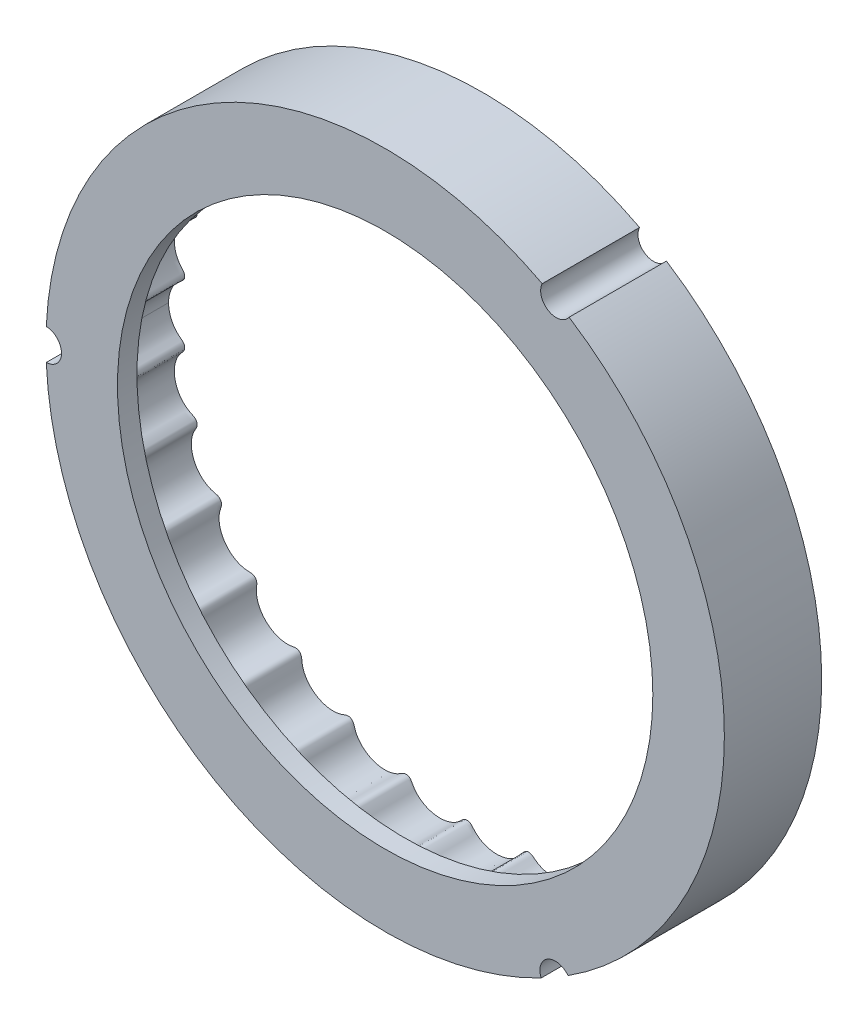
from build123d import *

# Parameters (mm, degrees)
ESQUISSE1_R             = 34.85
BOSS_EXTRU_1_DEPTH      = 8
ESQUISSE3_R             = 34.85
ESQUISSE3_R_2           = 27.5
BOSS_EXTRU_2_DEPTH      = 2
ESQUISSE4_R             = 1.6
ENL_V_MAT_EXTRU_2_DEPTH = 51.289611412


with BuildPart() as part:
    # Esquisse1 → Boss.-Extru.1 (new body)
    with BuildSketch(Plane.XY):
        Circle(ESQUISSE1_R)
        with BuildLine():
            add(Edge.make_bspline(
                [(30.75, 0), (30.75, -0.012466551), (30.750978291, -0.037435326), (30.755380523, -0.087337177), (30.767021407, -0.146605526), (30.784235638, -0.201639987), (30.806725403, -0.255918868), (30.840935147, -0.321123985), (30.887422434, -0.389111538), (30.947096406, -0.458089435), (31.018450958, -0.527969594), (31.087642774, -0.591592772), (31.173963904, -0.671262461), (31.275013947, -0.769628319), (31.418667793, -0.925049962), (31.590505656, -1.149287713), (31.765198528, -1.440584759), (31.922692534, -1.804453032), (32.034958648, -2.194853386), (32.098455422, -2.605847675), (32.110893976, -3.018484836), (32.074041221, -3.426596924), (31.989674774, -3.824502644), (31.859579575, -4.20675551), (31.685835108, -4.56634961), (31.470950798, -4.897742168), (31.24907067, -5.158368371), (31.037624658, -5.355859269), (30.846956876, -5.502834102), (30.686542549, -5.609708869), (30.511303765, -5.713032229), (30.327949226, -5.826454032), (30.173095555, -5.998578141), (30.093232003, -6.229100949), (30.110193836, -6.460044438), (30.200515583, -6.65648558), (30.319195295, -6.81880241), (30.429591873, -6.972377134), (30.556884573, -7.171669121), (30.686990471, -7.42432627), (30.81051827, -7.752064551), (30.902306801, -8.157965927), (30.939306602, -8.590969655), (30.91541063, -9.043225199), (30.833120238, -9.47917927), (30.698564824, -9.892214886), (30.517499761, -10.276882491), (30.295359778, -10.628695383), (30.03663758, -10.942013482), (29.746966061, -11.212937701), (29.470433337, -11.410145285), (29.223317503, -11.547196269), (29.007991406, -11.641437129), (28.831489277, -11.706780195), (28.642058234, -11.769172318), (28.450045732, -11.863081746), (28.288329456, -12.026987259), (28.210287752, -12.224918325), (28.20346133, -12.405406571), (28.236785614, -12.570096872), (28.293783104, -12.715821968), (28.367996779, -12.873214243), (28.441734352, -13.051374202), (28.519282743, -13.279422724), (28.585875989, -13.561168059), (28.625891413, -13.901400281), (28.620176022, -14.296757725), (28.564173119, -14.692691042), (28.458894502, -15.083143097), (28.307859188, -15.458096406), (28.113801834, -15.812569773), (27.879487833, -16.141681779), (27.607733235, -16.440542983), (27.304935504, -16.701120752), (26.975605605, -16.919348027), (26.668066278, -17.069716959), (26.395293942, -17.166332894), (26.161761798, -17.224796282), (25.972001086, -17.258905238), (25.77009755, -17.283912083), (25.556930978, -17.318589654), (25.348986278, -17.421268885), (25.189696924, -17.606062532), (25.120163479, -17.826984077), (25.130694209, -18.042573767), (25.176826858, -18.238110843), (25.216893076, -18.422953837), (25.254028667, -18.656404758), (25.272254044, -18.939939771), (25.254622928, -19.289611344), (25.176827173, -19.698288661), (25.038154347, -20.109986708), (24.836067152, -20.515105141), (24.583785661, -20.886782695), (24.287592504, -21.219855725), (23.953496641, -21.509650647), (23.587386146, -21.751686499), (23.210135668, -21.933657843), (22.873869304, -22.043643078), (22.591374487, -22.102148479), (22.325158766, -22.133594977), (22.101571409, -22.140706228), (21.878531137, -22.127472643), (21.64366765, -22.109610546), (21.438911553, -22.128790646), (21.235010271, -22.221372978), (21.072081402, -22.396691751), (20.993021331, -22.612875938), (20.985637564, -22.829397015), (20.992657275, -23.032781427), (20.989114789, -23.225634535), (20.969103016, -23.465571964), (20.917534051, -23.750425404), (20.818402107, -24.078217858), (20.655461136, -24.438354859), (20.446318236, -24.77898339), (20.131259913, -25.173976814), (19.681623457, -25.583288583), (19.159101878, -25.898679173), (18.590417327, -26.101603516), (18.101715984, -26.187940575), (17.759635951, -26.202985797), (17.470900281, -26.182588302), (17.23345446, -26.142771473), (17.045752759, -26.098427136), (16.850546694, -26.04105894), (16.639855437, -25.991807329), (16.410596194, -26.010096582), (16.197941083, -26.119984154), (16.054054554, -26.291655725), (15.981224755, -26.484264107), (15.946773384, -26.67216042), (15.913564985, -26.847713157), (15.871685839, -27.021430326), (15.818449071, -27.192101981), (15.738226672, -27.400602374), (15.563680399, -27.758482427), (15.294509879, -28.138551919), (14.917145191, -28.511493641), (14.463348217, -28.825916643), (14.067254883, -29.030313323), (13.644707988, -29.182609996), (13.202266996, -29.278018794), (12.769160471, -29.310447345), (12.354022164, -29.284747019), (12.010913039, -29.215435201), (11.740678008, -29.127800828), (11.523693584, -29.034133165), (11.354530851, -28.949519002), (11.177174481, -28.855377593), (10.972347739, -28.788140756), (10.740900032, -28.795902093), (10.520165877, -28.899715369), (10.365449548, -29.072753766), (10.276488974, -29.269813162), (10.202138665, -29.459209799), (10.122065567, -29.634640688), (10.007780433, -29.846547273), (9.846740686, -30.087038042), (9.624994499, -30.347917925), (9.257073915, -30.680872369), (8.748044271, -31.005547481), (8.178506642, -31.224841958), (7.579451288, -31.328982908), (7.074194818, -31.33558044), (6.676837151, -31.291826712), (6.292424803, -31.199581901), (5.972732278, -31.076737502), (5.716146602, -30.942666011), (5.514413234, -30.811214119), (5.359908708, -30.695731217), (5.203466143, -30.565531259), (5.026930794, -30.439720932), (4.806886962, -30.371834664), (4.568763859, -30.395570685), (4.371718028, -30.501884115), (4.232419886, -30.652981867), (4.127613713, -30.812483406), (4.027239219, -30.960328748), (3.919539933, -31.102873512), (3.802517078, -31.238030468), (3.645681729, -31.39708508), (3.342807108, -31.655393467), (2.850196764, -31.953463879), (2.236864317, -32.159554757), (1.57334615, -32.232200172), (1.015521856, -32.196526691), (0.571557429, -32.107674615), (0.161283705, -31.964658139), (-0.209217883, -31.775370602), (-0.496194196, -31.574729658), (-0.708889751, -31.386328198), (-0.870479972, -31.213757884), (-0.991906569, -31.068751011), (-1.118600595, -30.912755833), (-1.283802812, -30.77364241), (-1.50177773, -30.695368016), (-1.745288935, -30.710453884), (-1.952773559, -30.813794282), (-2.109935037, -30.9617471), (-2.253484059, -31.105903729), (-2.396791197, -31.234857562), (-2.586266177, -31.383358797), (-2.829905081, -31.53946165), (-3.137313102, -31.690050518), (-3.511638872, -31.816266932), (-3.903126981, -31.89558302), (-4.305796572, -31.92693373), (-4.709428249, -31.91017939), (-5.108431436, -31.846078498), (-5.497253612, -31.735420208), (-5.870273183, -31.579083817), (-6.217378252, -31.380436639), (-6.533152655, -31.142394658), (-6.777297144, -30.902023384), (-6.958914424, -30.676536915), (-7.091402356, -30.4753478), (-7.186885131, -30.30782225), (-7.265867953, -30.152740478), (-7.346855679, -30.018784595), (-7.457681197, -29.892404345), (-7.60553599, -29.788631328), (-7.810335103, -29.731112085), (-8.038593116, -29.760689184), (-8.229618994, -29.856257723), (-8.394816518, -29.9678965), (-8.554688939, -30.067243562), (-8.761219567, -30.179444188), (-9.021074936, -30.290468637), (-9.346448338, -30.387833531), (-9.738074935, -30.45039329), (-10.144176955, -30.462548242), (-10.558233153, -30.422238345), (-10.973080432, -30.329358), (-11.381841314, -30.182346239), (-11.776677722, -29.979979329), (-12.148584824, -29.721454636), (-12.467916496, -29.426609232), (-12.732187808, -29.105081948), (-12.915225976, -28.80641542), (-13.03487844, -28.548612507), (-13.114181552, -28.325794213), (-13.167788721, -28.144409516), (-13.22395419, -27.951277061), (-13.325570796, -27.760308071), (-13.499181016, -27.607119994), (-13.731038092, -27.531281103), (-13.961638649, -27.550325469), (-14.163155902, -27.626619217), (-14.352236725, -27.701671193), (-14.535020621, -27.762827079), (-14.768085048, -27.823174098), (-15.053755399, -27.868974691), (-15.395692291, -27.884288313), (-15.789188843, -27.850723971), (-16.278477536, -27.746331558), (-16.752840182, -27.560901205), (-17.194557572, -27.301468319), (-17.590716934, -26.97428386), (-17.87644948, -26.672015571), (-18.115919757, -26.343859054), (-18.306739131, -25.996227401), (-18.429482089, -25.679570016), (-18.501270208, -25.406255491), (-18.539399373, -25.174330622), (-18.558976893, -24.987108047), (-18.571760551, -24.78819228), (-18.61171465, -24.578519008), (-18.726239883, -24.378949606), (-18.895897533, -24.250627404), (-19.068047978, -24.195684752), (-19.235848336, -24.184165155), (-19.391500857, -24.201416651), (-19.562492555, -24.233940762), (-19.753354572, -24.26127601), (-19.993502931, -24.280111301), (-20.282978203, -24.275062722), (-20.62258955, -24.229742144), (-21.00431105, -24.126378447), (-21.374143581, -23.974062339), (-21.726452872, -23.775287984), (-22.052339004, -23.536012023), (-22.347665728, -23.260153139), (-22.608419903, -22.951625966), (-22.830585063, -22.614392221), (-23.008044532, -22.256577927), (-23.137966714, -21.883559883), (-23.207650802, -21.548434104), (-23.233868929, -21.260282098), (-23.232901154, -21.019548449), (-23.218935644, -20.827285344), (-23.19308791, -20.625499772), (-23.171395968, -20.410869823), (-23.21469466, -20.183284139), (-23.349964976, -19.980242783), (-23.544142607, -19.854031001), (-23.755029658, -19.806888177), (-23.955988469, -19.801799201), (-24.144986012, -19.794823888), (-24.380442174, -19.773074374), (-24.659723113, -19.720773466), (-25.102454644, -19.583748012), (-25.571923788, -19.333855047), (-26.003256706, -18.993006763), (-26.375870189, -18.571626824), (-26.625124857, -18.20215167), (-26.823075066, -17.806717527), (-26.966843844, -17.392192767), (-27.049756553, -16.981734052), (-27.073164572, -16.628783839), (-27.060044319, -16.340630955), (-27.030669176, -16.119187804), (-26.995774458, -15.943853854), (-26.949270457, -15.771357955), (-26.894033787, -15.601397958), (-26.831811628, -15.421030995), (-26.796169531, -15.21878135), (-26.830728435, -14.997622482), (-26.955806551, -14.793653857), (-27.143052722, -14.65948272), (-27.350369916, -14.595684207), (-27.549151744, -14.551819123), (-27.735133332, -14.500607364), (-27.96273584, -14.421993188), (-28.226061235, -14.301645035), (-28.519239284, -14.12455143), (-28.827934712, -13.877519508), (-29.106252012, -13.590487417), (-29.410945114, -13.187328958), (-29.648569421, -12.739752245), (-29.813457, -12.260672538), (-29.900219677, -11.763100346), (-29.920303758, -11.36407803), (-29.890631705, -10.970079215), (-29.820680989, -10.634943946), (-29.729600376, -10.360248477), (-29.632436108, -10.139979755), (-29.542989628, -9.969160834), (-29.438948985, -9.794318673), (-29.336710564, -9.603945127), (-29.292590558, -9.376156501), (-29.34341498, -9.137555324), (-29.477260018, -8.948550251), (-29.655010404, -8.826328968), (-29.837952398, -8.743428067), (-30.00852719, -8.661710233), (-30.215640088, -8.547820996), (-30.450678595, -8.388222873), (-30.715953105, -8.159786654), (-30.990944518, -7.847674225), (-31.231016889, -7.485674209), (-31.427032099, -7.077644595), (-31.565885953, -6.650463689), (-31.647333706, -6.212241917), (-31.671341992, -5.770595707), (-31.637967099, -5.332917719), (-31.550269505, -4.923309446), (-31.430833245, -4.590237023), (-31.303681047, -4.331264436), (-31.188262944, -4.139982886), (-31.086186829, -3.993222979), (-30.974688463, -3.853591969), (-30.856371815, -3.719709273), (-30.728634747, -3.577746879), (-30.619668631, -3.403178608), (-30.570027677, -3.184776013), (-30.611119827, -2.948973779), (-30.735347564, -2.755298657), (-30.902668511, -2.617892737), (-31.067663107, -2.498810148), (-31.217809804, -2.377731949), (-31.394966629, -2.21470965), (-31.588243327, -1.999182568), (-31.757029051, -1.761099309), (-31.899946191, -1.50432232), (-32.001745872, -1.278667082), (-32.072893478, -1.089795434), (-32.132225215, -0.897200595), (-32.179715684, -0.70082959), (-32.210893403, -0.527619645), (-32.230197764, -0.377050267), (-32.241336158, -0.25116251), (-32.247277005, -0.157631371), (-32.24950491, -0.064498225), (-32.25, -0.021409221), (-32.25, 0)],
                knots=[0.074164953, 0.074164953, 0.074164953, 0.074164953, 0.074164953, 0.07460362, 0.075042288, 0.075480956, 0.075919624, 0.076358291, 0.076796959, 0.077674294, 0.078376767, 0.07907924, 0.079781713, 0.080484186, 0.081889131, 0.083294077, 0.086103968, 0.088913859, 0.092014101, 0.095114343, 0.098214585, 0.101314828, 0.10432547, 0.107336113, 0.110346755, 0.113357398, 0.116234596, 0.119111795, 0.120550394, 0.121988994, 0.123427593, 0.124866193, 0.126640249, 0.128414306, 0.130187266, 0.131960225, 0.133373318, 0.13478641, 0.136199503, 0.137612595, 0.14043878, 0.143264965, 0.146639475, 0.150013985, 0.153388495, 0.156763005, 0.159864606, 0.162966207, 0.166067808, 0.169169409, 0.171979199, 0.17478899, 0.176193886, 0.177598781, 0.179003676, 0.180408572, 0.182166529, 0.183924486, 0.185705816, 0.186596481, 0.187487146, 0.188926547, 0.190365948, 0.191805349, 0.19324475, 0.196123553, 0.199002355, 0.202017429, 0.205032504, 0.208047579, 0.211062653, 0.214074396, 0.217086139, 0.220097882, 0.223109625, 0.225987087, 0.228864548, 0.230303278, 0.231742009, 0.23318074, 0.23461947, 0.23639559, 0.238171709, 0.239943897, 0.241716085, 0.243128759, 0.244541432, 0.245954105, 0.247366778, 0.250192125, 0.253017472, 0.256390807, 0.259764143, 0.263137479, 0.266510814, 0.269781576, 0.273052337, 0.276323099, 0.27959386, 0.282263597, 0.283598466, 0.284933335, 0.287603072, 0.288937941, 0.290272809, 0.291978349, 0.293683888, 0.295463294, 0.297242701, 0.298681812, 0.300120924, 0.301560035, 0.302999146, 0.305877369, 0.308755592, 0.311769369, 0.314783146, 0.317796922, 0.323823638, 0.329849516, 0.332862455, 0.335740475, 0.338618495, 0.340057505, 0.341496515, 0.342935526, 0.344374536, 0.346152362, 0.347930189, 0.349637201, 0.351344213, 0.352679183, 0.354014153, 0.355349122, 0.356684092, 0.358019062, 0.359354032, 0.362023971, 0.368567294, 0.371838956, 0.375110618, 0.378483109, 0.3818556, 0.385228091, 0.388600583, 0.391425519, 0.394250455, 0.395662923, 0.397075391, 0.398487859, 0.399900327, 0.401671575, 0.403442823, 0.40522, 0.406997176, 0.408436108, 0.409875039, 0.411313971, 0.412752903, 0.415630766, 0.418508629, 0.42152116, 0.427546223, 0.433572959, 0.436587163, 0.439601368, 0.442615573, 0.445493951, 0.44837233, 0.449811519, 0.451250708, 0.452689897, 0.454129086, 0.455909198, 0.457689309, 0.459393993, 0.461098678, 0.462433521, 0.463768363, 0.465103206, 0.466438049, 0.467772891, 0.469107734, 0.471777419, 0.47831802, 0.484858622, 0.488232362, 0.491606102, 0.494979843, 0.498353583, 0.50117918, 0.504004778, 0.505417576, 0.506830375, 0.508243174, 0.509655973, 0.511428503, 0.513201034, 0.514976523, 0.516752012, 0.518190677, 0.519629342, 0.521068008, 0.522506673, 0.525384003, 0.528261333, 0.531272698, 0.534284062, 0.537295427, 0.540306791, 0.543322305, 0.546337819, 0.549353334, 0.552368848, 0.555247889, 0.55812693, 0.559566451, 0.561005971, 0.562445492, 0.563885012, 0.564775961, 0.56566691, 0.567448808, 0.569205741, 0.570962674, 0.572367569, 0.573772465, 0.57517736, 0.576582255, 0.579392045, 0.582201836, 0.585302986, 0.588404136, 0.591505286, 0.594606436, 0.597981309, 0.601356181, 0.604731054, 0.608105927, 0.610932446, 0.613758965, 0.615172225, 0.616585485, 0.617998745, 0.619412004, 0.621185051, 0.622958098, 0.624731365, 0.626504633, 0.627943229, 0.629381826, 0.630820423, 0.63225902, 0.635136214, 0.638013408, 0.641023709, 0.64403401, 0.650054612, 0.653155309, 0.656256005, 0.659356702, 0.662457399, 0.665267223, 0.668077047, 0.669481959, 0.670886871, 0.672291783, 0.673696695, 0.675452531, 0.677208368, 0.678991564, 0.679883162, 0.68077476, 0.682214218, 0.683653677, 0.685093136, 0.686532595, 0.689411513, 0.69229043, 0.695306386, 0.698322342, 0.701338298, 0.704354253, 0.707365251, 0.710376248, 0.713387245, 0.716398242, 0.719275486, 0.722152729, 0.723591351, 0.725029973, 0.726468595, 0.727907217, 0.729682016, 0.731456816, 0.733229603, 0.735002391, 0.736415329, 0.737828268, 0.739241207, 0.740654145, 0.743480023, 0.7463059, 0.753054164, 0.756428296, 0.759802428, 0.763072262, 0.766342096, 0.76961193, 0.772881764, 0.77555143, 0.776886264, 0.778221097, 0.779555931, 0.780890764, 0.782225598, 0.783560431, 0.785264184, 0.786967936, 0.78874869, 0.790529443, 0.791968729, 0.793408015, 0.7948473, 0.796286586, 0.799165157, 0.802043728, 0.805058366, 0.808073004, 0.811087641, 0.817114411, 0.820126544, 0.823138676, 0.826150808, 0.829028446, 0.831906085, 0.833344904, 0.834783723, 0.836222542, 0.837661361, 0.839438045, 0.841214729, 0.842986489, 0.84475825, 0.846170813, 0.847583376, 0.848995939, 0.850408501, 0.853233627, 0.856058753, 0.859431672, 0.862804591, 0.86617751, 0.869550429, 0.872821645, 0.87609286, 0.879364076, 0.882635291, 0.885305113, 0.886640024, 0.887974936, 0.889309847, 0.890644758, 0.891979669, 0.89331458, 0.895020895, 0.896727211, 0.898505854, 0.900284498, 0.901723549, 0.903162601, 0.904601653, 0.906040705, 0.908918809, 0.911796913, 0.91330359, 0.914810268, 0.916316945, 0.917823622, 0.919330299, 0.920836976, 0.921590315, 0.922343654, 0.923096992, 0.923850331, 0.923850331, 0.923850331, 0.923850331, 0.923850331], degree=4))
            add(Edge.make_bspline(
                [(30.75, 0), (30.75, 0.012466551), (30.750978291, 0.037435326), (30.755380523, 0.087337177), (30.767021407, 0.146605526), (30.784235638, 0.201639987), (30.806725403, 0.255918868), (30.840935147, 0.321123985), (30.887422434, 0.389111538), (30.947096406, 0.458089435), (31.018450958, 0.527969594), (31.087642774, 0.591592772), (31.173963904, 0.671262461), (31.275013947, 0.769628319), (31.418667793, 0.925049962), (31.590505656, 1.149287713), (31.765198528, 1.440584759), (31.922692534, 1.804453032), (32.034958648, 2.194853386), (32.098455422, 2.605847675), (32.110893976, 3.018484836), (32.074041221, 3.426596924), (31.989674774, 3.824502644), (31.859579575, 4.20675551), (31.685835108, 4.566349611), (31.470950798, 4.897742168), (31.24907067, 5.158368371), (31.037624658, 5.355859269), (30.846956876, 5.502834102), (30.686542549, 5.609708869), (30.511303765, 5.713032229), (30.327949226, 5.826454032), (30.173095555, 5.998578141), (30.093232003, 6.229100949), (30.110193836, 6.460044438), (30.200515583, 6.65648558), (30.319195295, 6.81880241), (30.429591873, 6.972377134), (30.556884573, 7.171669121), (30.686990471, 7.42432627), (30.81051827, 7.752064551), (30.902306801, 8.157965927), (30.939306602, 8.590969655), (30.91541063, 9.043225199), (30.833120238, 9.47917927), (30.698564824, 9.892214886), (30.517499761, 10.276882491), (30.295359778, 10.628695384), (30.03663758, 10.942013482), (29.746966061, 11.212937701), (29.470433337, 11.410145285), (29.223317503, 11.547196269), (29.007991406, 11.641437129), (28.831489277, 11.706780195), (28.642058234, 11.769172318), (28.450045732, 11.863081747), (28.288329456, 12.026987259), (28.210287752, 12.224918325), (28.20346133, 12.405406571), (28.236785614, 12.570096872), (28.293783104, 12.715821968), (28.367996779, 12.873214243), (28.441734352, 13.051374202), (28.519282743, 13.279422724), (28.585875989, 13.561168059), (28.625891413, 13.901400281), (28.620176022, 14.296757725), (28.564173119, 14.692691042), (28.458894502, 15.083143097), (28.307859188, 15.458096406), (28.113801834, 15.812569773), (27.879487833, 16.141681779), (27.607733235, 16.440542983), (27.304935504, 16.701120752), (26.975605605, 16.919348027), (26.668066278, 17.069716959), (26.395293942, 17.166332894), (26.161761798, 17.224796282), (25.972001086, 17.258905238), (25.77009755, 17.283912083), (25.556930978, 17.318589654), (25.348986278, 17.421268885), (25.189696924, 17.606062532), (25.120163479, 17.826984077), (25.130694209, 18.042573767), (25.176826858, 18.238110843), (25.216893076, 18.422953837), (25.254028667, 18.656404758), (25.272254044, 18.939939771), (25.254622928, 19.289611344), (25.176827173, 19.698288661), (25.038154347, 20.109986708), (24.836067152, 20.515105141), (24.583785661, 20.886782695), (24.287592504, 21.219855725), (23.953496641, 21.509650647), (23.587386146, 21.751686499), (23.210135668, 21.933657843), (22.873869304, 22.043643078), (22.591374487, 22.102148479), (22.325158766, 22.133594977), (22.101571409, 22.140706228), (21.878531137, 22.127472643), (21.64366765, 22.109610546), (21.438911553, 22.128790646), (21.235010271, 22.221372978), (21.072081402, 22.396691751), (20.993021331, 22.612875938), (20.985637564, 22.829397015), (20.992657275, 23.032781427), (20.989114789, 23.225634535), (20.969103016, 23.465571964), (20.917534051, 23.750425404), (20.818402107, 24.078217858), (20.655461136, 24.438354859), (20.446318236, 24.77898339), (20.131259913, 25.173976814), (19.681623457, 25.583288583), (19.159101878, 25.898679173), (18.590417327, 26.101603516), (18.101715984, 26.187940575), (17.759635951, 26.202985797), (17.470900281, 26.182588302), (17.23345446, 26.142771473), (17.045752759, 26.098427136), (16.850546694, 26.04105894), (16.639855437, 25.991807329), (16.410596194, 26.010096582), (16.197941083, 26.119984154), (16.054054553, 26.291655725), (15.981224755, 26.484264107), (15.946773384, 26.67216042), (15.913564985, 26.847713157), (15.871685839, 27.021430326), (15.818449071, 27.192101981), (15.738226672, 27.400602374), (15.563680399, 27.758482427), (15.294509879, 28.138551919), (14.917145191, 28.511493641), (14.463348217, 28.825916643), (14.067254883, 29.030313323), (13.644707988, 29.182609996), (13.202266996, 29.278018794), (12.769160471, 29.310447345), (12.354022164, 29.284747019), (12.010913039, 29.215435201), (11.740678008, 29.127800828), (11.523693584, 29.034133165), (11.354530851, 28.949519002), (11.177174481, 28.855377593), (10.972347739, 28.788140756), (10.740900032, 28.795902093), (10.520165877, 28.899715369), (10.365449548, 29.072753766), (10.276488974, 29.269813162), (10.202138665, 29.459209799), (10.122065567, 29.634640688), (10.007780433, 29.846547273), (9.846740686, 30.087038042), (9.624994499, 30.347917925), (9.257073915, 30.680872369), (8.748044271, 31.005547481), (8.178506642, 31.224841958), (7.579451288, 31.328982908), (7.074194818, 31.33558044), (6.676837151, 31.291826712), (6.292424803, 31.199581901), (5.972732278, 31.076737502), (5.716146602, 30.942666011), (5.514413234, 30.811214119), (5.359908708, 30.695731217), (5.203466143, 30.565531259), (5.026930794, 30.439720932), (4.806886962, 30.371834664), (4.568763859, 30.395570685), (4.371718028, 30.501884115), (4.232419886, 30.652981867), (4.127613713, 30.812483406), (4.027239219, 30.960328748), (3.919539933, 31.102873512), (3.802517078, 31.238030468), (3.645681729, 31.39708508), (3.342807108, 31.655393467), (2.850196764, 31.953463879), (2.236864317, 32.159554757), (1.57334615, 32.232200172), (1.015521856, 32.196526691), (0.571557429, 32.107674615), (0.161283705, 31.964658139), (-0.209217883, 31.775370602), (-0.496194196, 31.574729658), (-0.708889751, 31.386328198), (-0.870479972, 31.213757884), (-0.991906569, 31.068751012), (-1.118600595, 30.912755833), (-1.283802812, 30.77364241), (-1.50177773, 30.695368016), (-1.745288935, 30.710453884), (-1.952773559, 30.813794282), (-2.109935037, 30.9617471), (-2.253484059, 31.105903729), (-2.396791197, 31.234857562), (-2.586266177, 31.383358797), (-2.829905082, 31.53946165), (-3.137313102, 31.690050518), (-3.511638872, 31.816266932), (-3.903126981, 31.89558302), (-4.305796572, 31.92693373), (-4.709428249, 31.91017939), (-5.108431436, 31.846078498), (-5.497253612, 31.735420208), (-5.870273183, 31.579083817), (-6.217378252, 31.380436639), (-6.533152655, 31.142394658), (-6.777297144, 30.902023384), (-6.958914424, 30.676536915), (-7.091402356, 30.4753478), (-7.186885131, 30.30782225), (-7.265867953, 30.152740478), (-7.346855679, 30.018784595), (-7.457681197, 29.892404345), (-7.60553599, 29.788631328), (-7.810335103, 29.731112085), (-8.038593116, 29.760689184), (-8.229618994, 29.856257723), (-8.394816518, 29.9678965), (-8.554688939, 30.067243562), (-8.761219567, 30.179444188), (-9.021074936, 30.290468637), (-9.346448338, 30.387833531), (-9.738074935, 30.45039329), (-10.144176955, 30.462548242), (-10.558233153, 30.422238345), (-10.973080432, 30.329358), (-11.381841314, 30.182346239), (-11.776677722, 29.979979329), (-12.148584824, 29.721454636), (-12.467916496, 29.426609232), (-12.732187808, 29.105081948), (-12.915225976, 28.80641542), (-13.03487844, 28.548612507), (-13.114181552, 28.325794213), (-13.167788721, 28.144409516), (-13.22395419, 27.951277061), (-13.325570796, 27.760308071), (-13.499181016, 27.607119994), (-13.731038092, 27.531281103), (-13.961638649, 27.550325469), (-14.163155902, 27.626619217), (-14.352236725, 27.701671193), (-14.535020621, 27.762827079), (-14.768085048, 27.823174098), (-15.053755399, 27.868974691), (-15.395692291, 27.884288313), (-15.789188843, 27.850723971), (-16.278477536, 27.746331558), (-16.752840182, 27.560901205), (-17.194557572, 27.301468319), (-17.590716934, 26.97428386), (-17.87644948, 26.672015571), (-18.115919757, 26.343859054), (-18.306739131, 25.996227401), (-18.429482089, 25.679570016), (-18.501270208, 25.406255491), (-18.539399373, 25.174330622), (-18.558976893, 24.987108047), (-18.571760551, 24.78819228), (-18.61171465, 24.578519008), (-18.726239883, 24.378949606), (-18.895897533, 24.250627404), (-19.068047978, 24.195684752), (-19.235848336, 24.184165155), (-19.391500857, 24.201416651), (-19.562492555, 24.233940762), (-19.753354572, 24.26127601), (-19.993502931, 24.280111301), (-20.282978203, 24.275062722), (-20.62258955, 24.229742144), (-21.00431105, 24.126378447), (-21.374143581, 23.974062339), (-21.726452872, 23.775287984), (-22.052339004, 23.536012023), (-22.347665728, 23.260153139), (-22.608419903, 22.951625966), (-22.830585063, 22.614392221), (-23.008044532, 22.256577927), (-23.137966714, 21.883559883), (-23.207650802, 21.548434104), (-23.233868929, 21.260282098), (-23.232901154, 21.019548449), (-23.218935644, 20.827285344), (-23.19308791, 20.625499772), (-23.171395968, 20.410869823), (-23.21469466, 20.183284139), (-23.349964976, 19.980242783), (-23.544142607, 19.854031001), (-23.755029658, 19.806888177), (-23.955988469, 19.801799201), (-24.144986012, 19.794823888), (-24.380442174, 19.773074374), (-24.659723113, 19.720773466), (-25.102454644, 19.583748012), (-25.571923788, 19.333855047), (-26.003256706, 18.993006763), (-26.375870189, 18.571626824), (-26.625124857, 18.20215167), (-26.823075066, 17.806717527), (-26.966843844, 17.392192767), (-27.049756553, 16.981734052), (-27.073164572, 16.628783839), (-27.060044319, 16.340630955), (-27.030669176, 16.119187804), (-26.995774458, 15.943853854), (-26.949270457, 15.771357955), (-26.894033787, 15.601397958), (-26.831811628, 15.421030995), (-26.796169531, 15.21878135), (-26.830728435, 14.997622482), (-26.955806551, 14.793653857), (-27.143052723, 14.65948272), (-27.350369916, 14.595684207), (-27.549151744, 14.551819123), (-27.735133332, 14.500607364), (-27.96273584, 14.421993188), (-28.226061235, 14.301645035), (-28.519239284, 14.12455143), (-28.827934712, 13.877519508), (-29.106252012, 13.590487417), (-29.410945114, 13.187328958), (-29.648569421, 12.739752245), (-29.813457, 12.260672538), (-29.900219677, 11.763100346), (-29.920303758, 11.36407803), (-29.890631705, 10.970079215), (-29.820680989, 10.634943946), (-29.729600376, 10.360248477), (-29.632436108, 10.139979755), (-29.542989628, 9.969160834), (-29.438948985, 9.794318673), (-29.336710564, 9.603945127), (-29.292590558, 9.376156501), (-29.34341498, 9.137555324), (-29.477260018, 8.948550251), (-29.655010404, 8.826328968), (-29.837952398, 8.743428067), (-30.00852719, 8.661710233), (-30.215640088, 8.547820996), (-30.450678595, 8.388222873), (-30.715953105, 8.159786654), (-30.990944518, 7.847674225), (-31.231016889, 7.485674209), (-31.427032099, 7.077644595), (-31.565885953, 6.650463689), (-31.647333706, 6.212241917), (-31.671341992, 5.770595707), (-31.637967099, 5.332917719), (-31.550269505, 4.923309446), (-31.430833245, 4.590237023), (-31.303681047, 4.331264436), (-31.188262944, 4.139982886), (-31.086186829, 3.993222979), (-30.974688463, 3.853591969), (-30.856371815, 3.719709273), (-30.728634747, 3.577746879), (-30.619668631, 3.403178608), (-30.570027677, 3.184776013), (-30.611119827, 2.948973779), (-30.735347564, 2.755298657), (-30.902668511, 2.617892737), (-31.067663107, 2.498810148), (-31.217809804, 2.377731949), (-31.394966629, 2.21470965), (-31.588243327, 1.999182568), (-31.757029051, 1.761099309), (-31.899946191, 1.50432232), (-32.001745872, 1.278667082), (-32.072893478, 1.089795434), (-32.132225215, 0.897200595), (-32.179715684, 0.70082959), (-32.210893403, 0.527619645), (-32.230197764, 0.377050267), (-32.241336158, 0.25116251), (-32.247277005, 0.157631371), (-32.24950491, 0.064498225), (-32.25, 0.021409221), (-32.25, 0)],
                knots=[0.074164953, 0.074164953, 0.074164953, 0.074164953, 0.074164953, 0.07460362, 0.075042288, 0.075480956, 0.075919624, 0.076358291, 0.076796959, 0.077674294, 0.078376767, 0.07907924, 0.079781713, 0.080484186, 0.081889131, 0.083294077, 0.086103968, 0.088913859, 0.092014101, 0.095114343, 0.098214585, 0.101314828, 0.10432547, 0.107336113, 0.110346755, 0.113357398, 0.116234596, 0.119111795, 0.120550394, 0.121988994, 0.123427593, 0.124866193, 0.126640249, 0.128414306, 0.130187266, 0.131960225, 0.133373318, 0.13478641, 0.136199503, 0.137612595, 0.14043878, 0.143264965, 0.146639475, 0.150013985, 0.153388495, 0.156763005, 0.159864606, 0.162966207, 0.166067808, 0.169169409, 0.171979199, 0.17478899, 0.176193886, 0.177598781, 0.179003676, 0.180408572, 0.182166529, 0.183924486, 0.185705816, 0.186596481, 0.187487146, 0.188926547, 0.190365948, 0.191805349, 0.19324475, 0.196123553, 0.199002355, 0.202017429, 0.205032504, 0.208047579, 0.211062653, 0.214074396, 0.217086139, 0.220097882, 0.223109625, 0.225987087, 0.228864548, 0.230303278, 0.231742009, 0.23318074, 0.23461947, 0.23639559, 0.238171709, 0.239943897, 0.241716085, 0.243128759, 0.244541432, 0.245954105, 0.247366778, 0.250192125, 0.253017472, 0.256390807, 0.259764143, 0.263137479, 0.266510814, 0.269781576, 0.273052337, 0.276323099, 0.27959386, 0.282263597, 0.283598466, 0.284933335, 0.287603072, 0.288937941, 0.290272809, 0.291978349, 0.293683888, 0.295463294, 0.297242701, 0.298681812, 0.300120924, 0.301560035, 0.302999146, 0.305877369, 0.308755592, 0.311769369, 0.314783146, 0.317796922, 0.323823638, 0.329849516, 0.332862455, 0.335740475, 0.338618495, 0.340057505, 0.341496515, 0.342935526, 0.344374536, 0.346152362, 0.347930189, 0.349637201, 0.351344213, 0.352679183, 0.354014153, 0.355349122, 0.356684092, 0.358019062, 0.359354032, 0.362023971, 0.368567294, 0.371838956, 0.375110618, 0.378483109, 0.3818556, 0.385228091, 0.388600583, 0.391425519, 0.394250455, 0.395662923, 0.397075391, 0.398487859, 0.399900327, 0.401671575, 0.403442823, 0.40522, 0.406997176, 0.408436108, 0.409875039, 0.411313971, 0.412752903, 0.415630766, 0.418508629, 0.42152116, 0.427546223, 0.433572959, 0.436587163, 0.439601368, 0.442615573, 0.445493951, 0.44837233, 0.449811519, 0.451250708, 0.452689897, 0.454129086, 0.455909198, 0.457689309, 0.459393993, 0.461098678, 0.462433521, 0.463768363, 0.465103206, 0.466438049, 0.467772891, 0.469107734, 0.471777419, 0.47831802, 0.484858622, 0.488232362, 0.491606102, 0.494979843, 0.498353583, 0.50117918, 0.504004778, 0.505417576, 0.506830375, 0.508243174, 0.509655973, 0.511428503, 0.513201034, 0.514976523, 0.516752012, 0.518190677, 0.519629342, 0.521068008, 0.522506673, 0.525384003, 0.528261333, 0.531272698, 0.534284062, 0.537295427, 0.540306791, 0.543322305, 0.546337819, 0.549353334, 0.552368848, 0.555247889, 0.55812693, 0.559566451, 0.561005971, 0.562445492, 0.563885012, 0.564775961, 0.56566691, 0.567448808, 0.569205741, 0.570962674, 0.572367569, 0.573772465, 0.57517736, 0.576582255, 0.579392045, 0.582201836, 0.585302986, 0.588404136, 0.591505286, 0.594606436, 0.597981309, 0.601356181, 0.604731054, 0.608105927, 0.610932446, 0.613758965, 0.615172225, 0.616585485, 0.617998745, 0.619412004, 0.621185051, 0.622958098, 0.624731365, 0.626504633, 0.627943229, 0.629381826, 0.630820423, 0.63225902, 0.635136214, 0.638013408, 0.641023709, 0.64403401, 0.650054612, 0.653155309, 0.656256005, 0.659356702, 0.662457399, 0.665267223, 0.668077047, 0.669481959, 0.670886871, 0.672291783, 0.673696695, 0.675452531, 0.677208368, 0.678991564, 0.679883162, 0.68077476, 0.682214218, 0.683653677, 0.685093136, 0.686532595, 0.689411513, 0.69229043, 0.695306386, 0.698322342, 0.701338298, 0.704354253, 0.707365251, 0.710376248, 0.713387245, 0.716398242, 0.719275486, 0.722152729, 0.723591351, 0.725029973, 0.726468595, 0.727907217, 0.729682016, 0.731456816, 0.733229603, 0.735002391, 0.736415329, 0.737828268, 0.739241207, 0.740654145, 0.743480023, 0.7463059, 0.753054164, 0.756428296, 0.759802428, 0.763072262, 0.766342096, 0.76961193, 0.772881764, 0.77555143, 0.776886264, 0.778221097, 0.779555931, 0.780890764, 0.782225598, 0.783560431, 0.785264184, 0.786967936, 0.78874869, 0.790529443, 0.791968729, 0.793408015, 0.7948473, 0.796286586, 0.799165157, 0.802043728, 0.805058366, 0.808073004, 0.811087641, 0.817114411, 0.820126544, 0.823138676, 0.826150808, 0.829028446, 0.831906085, 0.833344904, 0.834783723, 0.836222542, 0.837661361, 0.839438045, 0.841214729, 0.842986489, 0.84475825, 0.846170813, 0.847583376, 0.848995939, 0.850408501, 0.853233627, 0.856058753, 0.859431672, 0.862804591, 0.86617751, 0.869550429, 0.872821645, 0.87609286, 0.879364076, 0.882635291, 0.885305113, 0.886640024, 0.887974936, 0.889309847, 0.890644758, 0.891979669, 0.89331458, 0.895020895, 0.896727211, 0.898505854, 0.900284498, 0.901723549, 0.903162601, 0.904601653, 0.906040705, 0.908918809, 0.911796913, 0.91330359, 0.914810268, 0.916316945, 0.917823622, 0.919330299, 0.920836976, 0.921590315, 0.922343654, 0.923096992, 0.923850331, 0.923850331, 0.923850331, 0.923850331, 0.923850331], degree=4))
        make_face(mode=Mode.SUBTRACT)
    extrude(amount=BOSS_EXTRU_1_DEPTH)

    # Esquisse3 → Boss.-Extru.2 (add)
    with BuildSketch(Plane.XY.offset(8)):
        Circle(ESQUISSE3_R)
        Circle(ESQUISSE3_R_2, mode=Mode.SUBTRACT)
    extrude(amount=BOSS_EXTRU_2_DEPTH)

    # Esquisse4 → Enlèv. mat.-Extru.2 (cut, through all)
    with BuildSketch(Plane.XY.offset(10)):
        with Locations((-34.85, 0)):
            Circle(ESQUISSE4_R)
        with Locations((17.575, 30.180985322)):
            Circle(ESQUISSE4_R)
        with Locations((17.5, -30.310889132)):
            Circle(ESQUISSE4_R)
    extrude(amount=-ENL_V_MAT_EXTRU_2_DEPTH, mode=Mode.SUBTRACT)


solid = part.part
